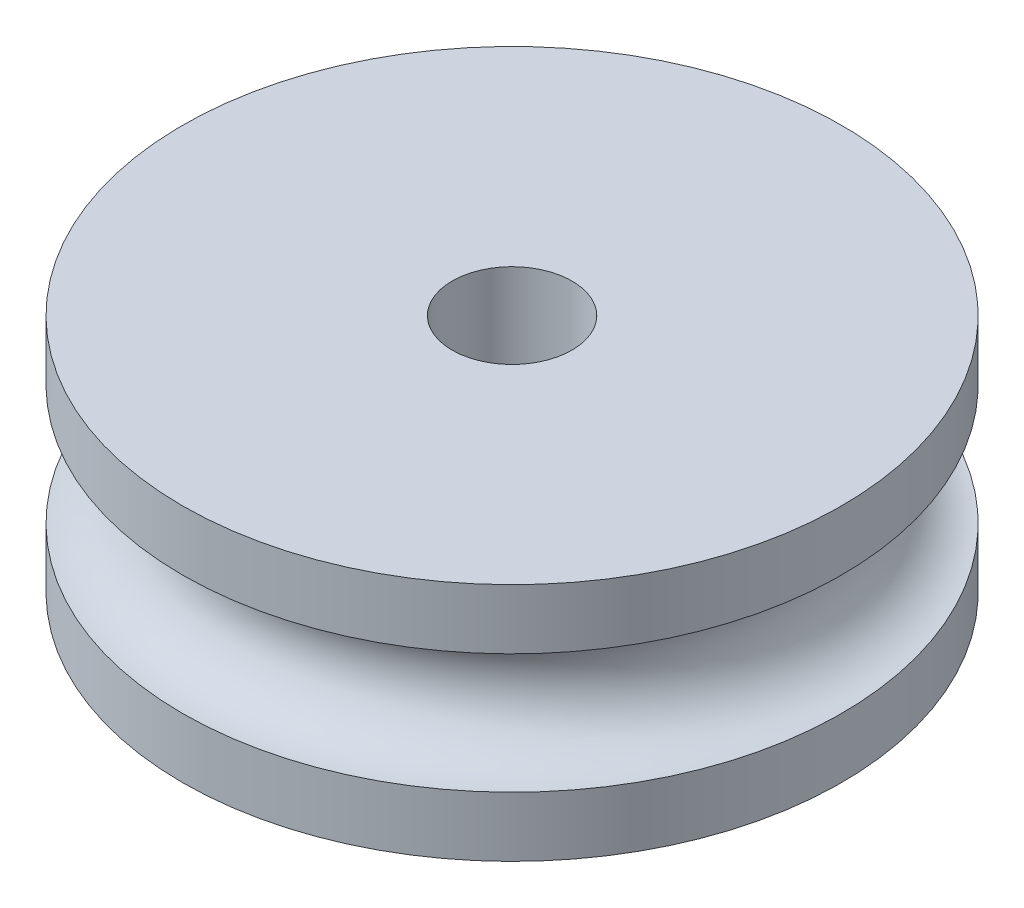
from build123d import *


with BuildPart() as part:
    # Croquis1 → Revolución1 (revolve)
    with BuildSketch(Plane(origin=(0, 0, -44.43), x_dir=(-1, 0, 0), z_dir=(0, 0, -1)), mode=Mode.PRIVATE) as revoluci_n1_sk:
        with BuildLine():
            Line((-81, 54.526431985), (-81, 53.526431985))
            ThreePointArc((-81, 53.526431985), (-80, 52.526431985), (-81, 51.526431985))
            Line((-81, 51.526431985), (-81, 50.526431985))
            Line((-81, 50.526431985), (-76.5, 50.526431985))
            Line((-76.5, 50.526431985), (-76.5, 54.526431985))
            Line((-76.5, 54.526431985), (-81, 54.526431985))
        make_face()
    revolve(revoluci_n1_sk.sketch.rotate(Axis((75.5, 50.526431985, -44.43), (0, 1, 0)), 270), axis=Axis((75.5, 50.526431985, -44.43), (0, 1, 0)))


solid = part.part
